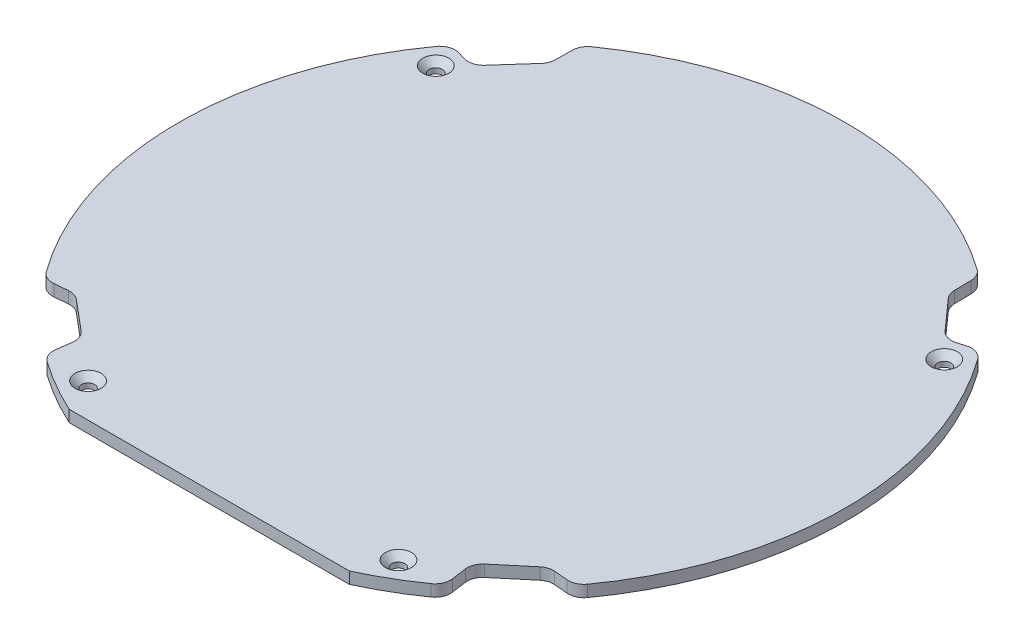
from build123d import *

# Parameters (mm, degrees)
RESSALTO_EXTRUS_O1_DEPTH            = 3
ESCAREADO_PARA_SFHCS_M31_AT_2_COUNT = 2
ESCAREADO_PARA_SFHCS_M31_AT_2_PITCH = 117.96437389
ESCAREADO_PARA_SFHCS_M31_AT_3_COUNT = 2
ESCAREADO_PARA_SFHCS_M31_AT_3_PITCH = 80
ESCAREADO_PARA_SFHCS_M31_AT_4_COUNT = 2
ESCAREADO_PARA_SFHCS_M31_AT_4_PITCH = 156.207361139
FILETE1_R                           = 4


with BuildPart() as part:
    # Esboço1 → Ressalto-extrusão1 (new body)
    with BuildSketch(Plane(origin=(0, 0, 0), x_dir=(1, 0, 0), z_dir=(0, 1, 0))):
        with BuildLine():
            Line((-68.089865002, 52.533515816), (-60.990156529, 50.415201884))
            Line((-60.990156529, 50.415201884), (-51.474506905, 61.094962266))
            Line((-51.474506905, 61.094962266), (-51.366345618, 68.974622419))
            ThreePointArc((-51.366345618, 68.974622419), (0, 86), (51.366345618, 68.974622419))
            Line((51.366345618, 68.974622419), (51.474506905, 61.094962266))
            Line((51.474506905, 61.094962266), (60.990156529, 50.415201884))
            Line((60.990156529, 50.415201884), (68.089865002, 52.533515816))
            ThreePointArc((68.089865002, 52.533515816), (85.999638052, 0.24950947), (68.393545574, -52.137538529))
            Line((68.393545574, -52.137538529), (60.990156529, -51.512941417))
            Line((60.990156529, -51.512941417), (50.318654012, -60.477268457))
            Line((50.318654012, -60.477268457), (51.474506905, -68.893941235))
            ThreePointArc((51.474506905, -68.893941235), (44.026252256, -73.876174185), (36.1, -78.056325817))
            Line((36.1, -78.056325817), (-36.1, -78.056325817))
            ThreePointArc((-36.1, -78.056325817), (-44.026252256, -73.876174185), (-51.474506905, -68.893941235))
            Line((-51.474506905, -68.893941235), (-50.318654012, -60.477268457))
            Line((-50.318654012, -60.477268457), (-60.990156529, -51.512941417))
            Line((-60.990156529, -51.512941417), (-68.393545574, -52.137538529))
            ThreePointArc((-68.393545574, -52.137538529), (-85.999638052, 0.24950947), (-68.089865002, 52.533515816))
        make_face()
    extrude(amount=RESSALTO_EXTRUS_O1_DEPTH)

    # Esboço3 → Escareado para SFHCS M31 (revolve, cut)
    with BuildSketch(Plane(origin=(40, 3, 69.282032303), x_dir=(0, 0, 1), z_dir=(1, 0, 0))):
        Polygon((0, 0), (0, 3), (1.7, 3), (1.7, 1.66), (3.36, 0), align=None)
    escareado_para_sfhcs_m31 = revolve(axis=Axis((40, 9.35, 69.282032303), (0, -1, 0)), mode=Mode.SUBTRACT)

    # Escareado para SFHCS M31 at 2: Escareado para SFHCS M31 ×2
    with Locations(*[Vector(0.21643961393810332, 0, -0.9762960071199333) * (i * ESCAREADO_PARA_SFHCS_M31_AT_2_PITCH) for i in range(1, ESCAREADO_PARA_SFHCS_M31_AT_2_COUNT)]):
        add(escareado_para_sfhcs_m31, mode=Mode.SUBTRACT)

    # Escareado para SFHCS M31 at 3: Escareado para SFHCS M31 ×2
    with Locations(*[(-i * ESCAREADO_PARA_SFHCS_M31_AT_3_PITCH, 0, 0) for i in range(1, ESCAREADO_PARA_SFHCS_M31_AT_3_COUNT)]):
        add(escareado_para_sfhcs_m31, mode=Mode.SUBTRACT)

    # Escareado para SFHCS M31 at 4: Escareado para SFHCS M31 ×2
    with Locations(*[Vector(-0.6755902076156564, 0, -0.7372773368101276) * (i * ESCAREADO_PARA_SFHCS_M31_AT_4_PITCH) for i in range(1, ESCAREADO_PARA_SFHCS_M31_AT_4_COUNT)]):
        add(escareado_para_sfhcs_m31, mode=Mode.SUBTRACT)

    # Filete1
    filete1_edges = [part.edges().sort_by_distance(p)[0] for p in [
        (-68.089865002, 1.5, -52.533515816),
        (-60.990156529, 1.5, -50.415201884),
        (-51.474506905, 1.5, -61.094962266),
        (-51.366345618, 1.5, -68.974622419),
        (51.366345618, 1.5, -68.974622419),
        (51.474506905, 1.5, -61.094962266),
        (60.990156529, 1.5, -50.415201884),
        (68.089865002, 1.5, -52.533515816),
        (68.393545574, 1.5, 52.137538529),
        (60.990156529, 1.5, 51.512941417),
        (50.318654012, 1.5, 60.477268457),
        (51.474506905, 1.5, 68.893941235),
        (-51.474506905, 1.5, 68.893941235),
        (-50.318654012, 1.5, 60.477268457),
        (-60.990156529, 1.5, 51.512941417),
        (-68.393545574, 1.5, 52.137538529),
    ]]
    fillet(filete1_edges, radius=FILETE1_R)


solid = part.part
